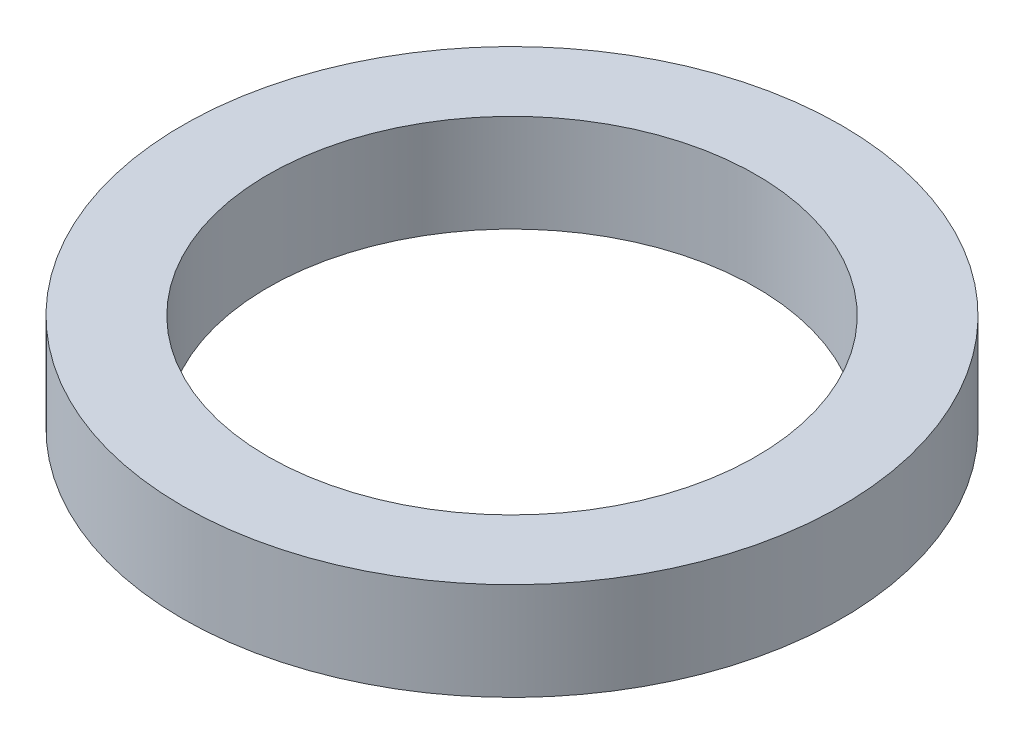
from build123d import *

# Parameters (mm, degrees)
SKETCH_1_R      = 13.5
SKETCH_1_R_2    = 10
EXTRUDE_1_DEPTH = 4


with BuildPart() as part:
    # 草图1 → 凸台-拉伸1 (new body)
    with BuildSketch(Plane(origin=(0, 0, 0), x_dir=(1, 0, 0), z_dir=(0, 1, 0))):
        with Locations(Location((0, 0, 0), (0, 0, 270))):
            Circle(SKETCH_1_R)
        with Locations(Location((0, 0, 0), (0, 0, 270))):
            Circle(SKETCH_1_R_2, mode=Mode.SUBTRACT)
    extrude(amount=EXTRUDE_1_DEPTH)


solid = part.part
